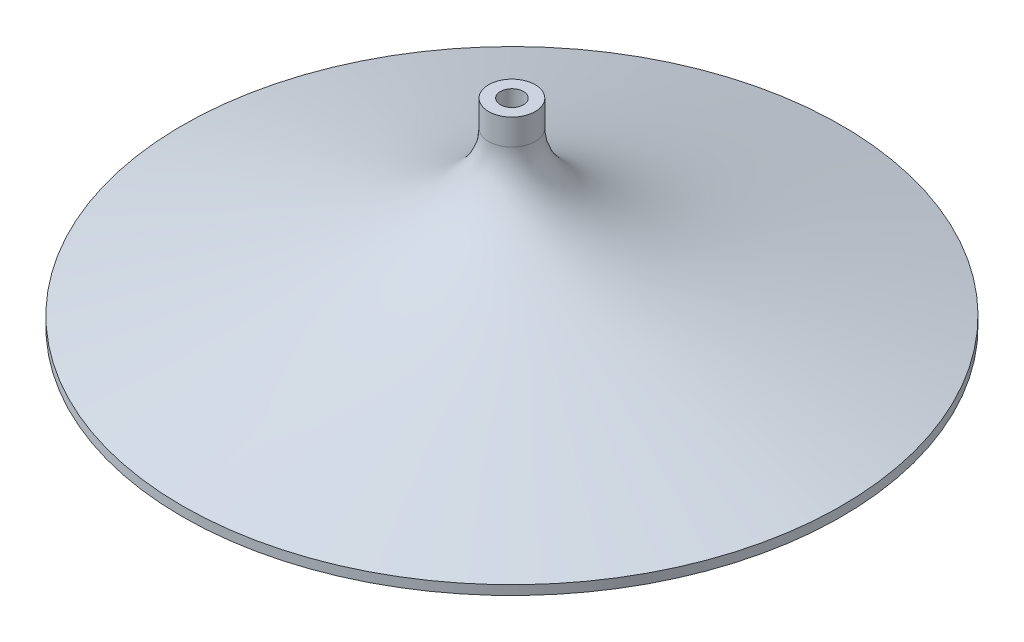
from build123d import *

# Parameters (mm, degrees)
SKETCH2_R          = 3
CUT_EXTRUDE2_DEPTH = 10


with BuildPart() as part:
    # Sketch1 → Revolve1 (revolve)
    with BuildSketch(Plane.XY, mode=Mode.PRIVATE) as revolve1_sk:
        with BuildLine():
            Line((100, 2.844477336), (100, 0))
            add(Edge.make_bspline(
                [(100, 0), (90.312762525, 0), (43.119706996, 15.073582884), (9.43857005, 32.11606328), (3.5, 40.928765801), (3.5, 41.163912301)],
                knots=[0, 0, 0, 0, 0.641468737, 0.741468737, 1, 1, 1, 1], degree=3))
            Line((3.5, 41.163912301), (3.5, 60))
            Line((3.5, 60), (7.057288072, 60))
            Line((7.057288072, 60), (7.057288072, 52.125008745))
            add(Edge.make_bspline(
                [(100, 2.844477336), (58.263448469, 15.906011625), (27.953606397, 25.195125562), (7.057288072, 41.21441144), (7.057288072, 52.125008745)],
                knots=[0, 0, 0, 0, 0.525870122, 1, 1, 1, 1], degree=3))
        make_face()
    revolve(revolve1_sk.sketch.rotate(Axis((0, 82.920033306, 0), (0, -1, 0)), 90), axis=Axis((0, 82.920033306, 0), (0, -1, 0)))

    # Sketch2 → Cut-Extrude2 (cut)
    with BuildSketch(Plane(origin=(0, 0, 0), x_dir=(1, 0, 0), z_dir=(0, 1, 0))):
        with Locations(Location((-50, -50, 0), (0, 0, 90))):
            Circle(SKETCH2_R)
        with Locations(Location((50, -50, 0), (0, 0, 90))):
            Circle(SKETCH2_R)
        with Locations(Location((50, 50, 0), (0, 0, 90))):
            Circle(SKETCH2_R)
        with Locations(Location((-50, 50, 0), (0, 0, 90))):
            Circle(SKETCH2_R)
    extrude(amount=CUT_EXTRUDE2_DEPTH, mode=Mode.SUBTRACT)


solid = part.part
